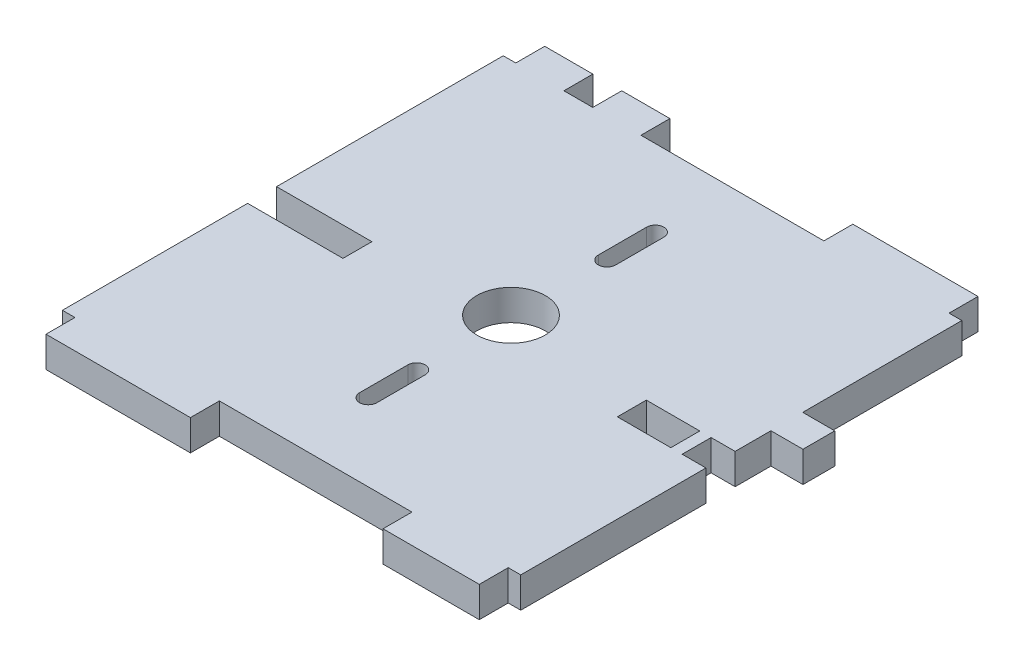
from build123d import *

# Parameters (mm, degrees)
SKETCH1_R           = 3.550069734
SKETCH1_W           = 5.542666669
SKETCH1_H           = 3.000080526
BOSS_EXTRUDE1_DEPTH = 3.175


with BuildPart() as part:
    # Sketch1 → Boss-Extrude1 (new body)
    with BuildSketch(Plane(origin=(0, 0, 0), x_dir=(1, 0, 0), z_dir=(0, 1, 0))):
        Polygon((21.594595228, 0.978080338), (21.594595228, -2.022000189), (24.059548337, -2.022000189), (24.059548337, -21.222556575), (22.761975246, -21.222556575), (22.761975246, -24.222705465), (12.779622417, -24.222705465), (12.779622417, -21.222556575), (-7.185015001, -21.222556575), (-7.185015001, -24.222705465), (-22.158349273, -24.222705465), (-22.158349273, -21.222556575), (-23.456117337, -21.222556575), (-23.456117337, -2.021873227), (-13.573249368, -2.021873227), (-13.573249368, 0.978275664), (-23.456117336, 0.978275664), (-23.456117336, 24.479227112), (-22.158349272, 24.479227112), (-22.158349272, 27.47917091), (-17.167172857, 27.47917091), (-17.167172857, 24.479227112), (-14.172644433, 24.479227112), (-14.172644433, 27.47917091), (-9.181477767, 27.47917091), (-9.181477767, 24.479227112), (9.784899021, 24.479227112), (9.784899021, 27.47917091), (22.761975247, 27.47917091), (22.761975247, 24.479227112), (24.059548338, 24.479227112), (24.08510927, 24.47910015), (24.08510927, 7.98726625), (27.405593185, 7.98726625), (27.405593185, 4.687262638), (24.08510927, 4.687262638), (24.08510927, 0.978080338), align=None)
        with Locations(Location((0.24664544, 1.581901392, 0), (0, 0, 270))):
            Circle(SKETCH1_R, mode=Mode.SUBTRACT)
        with Locations((17.647010615, -0.521959927)):
            Rectangle(SKETCH1_W, SKETCH1_H, mode=Mode.SUBTRACT)
        with BuildLine():
            Line((-0.638404245, 11.51973711), (-0.638404245, 16.519887597))
            ThreePointArc((-0.638404245, 16.519887597), (0.259966955, 17.418258798), (1.158338156, 16.519887597))
            Line((1.158338156, 16.519887597), (1.158338156, 11.51973711))
            ThreePointArc((1.158338156, 11.51973711), (0.259966955, 10.62136591), (-0.638404245, 11.51973711))
        make_face(mode=Mode.SUBTRACT)
        with BuildLine():
            Line((-0.651633149, -13.218614368), (-0.651633149, -8.218395516))
            ThreePointArc((-0.651633149, -8.218395516), (0.246738051, -7.320024316), (1.145109252, -8.218395516))
            Line((1.145109252, -8.218395516), (1.145109252, -13.218614368))
            ThreePointArc((1.145109252, -13.218614368), (0.246738051, -14.116985568), (-0.651633149, -13.218614368))
        make_face(mode=Mode.SUBTRACT)
    extrude(amount=BOSS_EXTRUDE1_DEPTH)


solid = part.part
